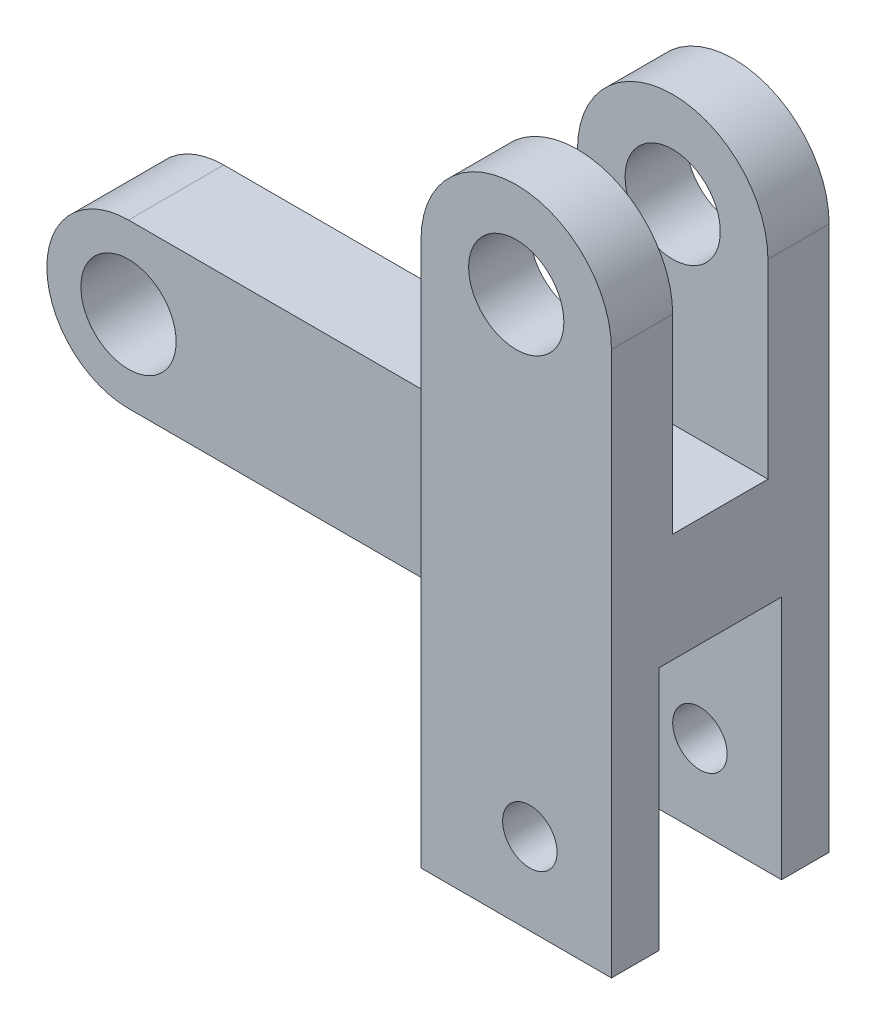
from build123d import *
from build123d.topology import SkipClean

# Parameters (mm, degrees)
SKETCH_1_W          = 7
SKETCH_1_H          = 7
EXTRUDE_1_DEPTH     = 2.4
EXTRUDE_6_DEPTH     = 1.75
EXTRUDE_START       = -5.25
EXTRUDE_8_DEPTH     = 1.75
SKETCH_11_R         = 1.75
CUT_EXTRUDE_1_DEPTH = 17.740669043
SKETCH_17_W         = 7
SKETCH_17_H         = 7
EXTRUDE_10_DEPTH    = 10
SKETCH_15_R         = 1.75
EXTRUDE_9_DEPTH     = 1.75
SKETCH_12_R         = 1
CUT_EXTRUDE_2_DEPTH = 23.383029286
SKETCH_18_W         = 7
SKETCH_18_H         = 4.5
CUT_EXTRUDE_4_DEPTH = 9
SKETCH_19_R         = 1
SKETCH_19_R_2       = 1.75
EXTRUDE_11_DEPTH    = 0.5
EXTRUDE_START_2     = 0.5
SKETCH_20_R         = 1
SKETCH_20_R_2       = 1.75
EXTRUDE_12_DEPTH    = 0.5


with BuildPart() as part:
    # 草图1 → 凸台-拉伸1 (new body)
    with BuildSketch(Plane(origin=(0, 0, 0), x_dir=(1, 0, 0), z_dir=(0, 1, 0))):
        with Locations((3.5, 0)):
            Rectangle(SKETCH_1_W, SKETCH_1_H)
    extrude(amount=EXTRUDE_1_DEPTH)

    # 草图10 → 凸台-拉伸6 (add)
    with BuildSketch(Plane(origin=(0, 0, -3.5), x_dir=(-1, 0, 0), z_dir=(0, 0, -1))):
        with BuildLine():
            Line((-7, 10), (-7, 2.4))
            Line((-7, 2.4), (0, 2.4))
            Line((0, 2.4), (0, 10))
            ThreePointArc((0, 10), (-3.5, 13.5), (-7, 10))
        make_face()
    extrude(amount=-EXTRUDE_6_DEPTH)

    # 草图10<2> → 凸台-拉伸8 (add)
    with BuildSketch(Plane(origin=(0, 0, -3.5), x_dir=(-1, 0, 0), z_dir=(0, 0, -1)).offset(EXTRUDE_START)):
        with BuildLine():
            Line((-7, 10), (-7, 2.4))
            Line((-7, 2.4), (0, 2.4))
            Line((0, 2.4), (0, 10))
            ThreePointArc((0, 10), (-3.5, 13.5), (-7, 10))
        make_face()
    extrude(amount=-EXTRUDE_8_DEPTH)

    # 草图11 → 切除-拉伸1 (cut, through all)
    with BuildSketch(Plane(origin=(0, 0, -3.5), x_dir=(-1, 0, 0), z_dir=(0, 0, -1))):
        with Locations((-3.5, 10)):
            Circle(SKETCH_11_R)
    extrude(amount=-CUT_EXTRUDE_1_DEPTH, mode=Mode.SUBTRACT)

    # 草图17 → 凸台-拉伸10 (add)
    with BuildSketch(Plane.XZ):
        with Locations((3.5, 0)):
            Rectangle(SKETCH_17_W, SKETCH_17_H)
    extrude(amount=EXTRUDE_10_DEPTH)

    # 草图15 → 凸台-拉伸9 (add, symmetric)
    with BuildSketch(Plane.XY):
        with BuildLine():
            Line((7, 2.4), (7, 3))
            Line((7, 3), (-13, 3))
            ThreePointArc((-13, 3), (-16, 0), (-13, -3))
            Line((-13, -3), (7, -3))
            Line((7, -3), (7, 2.4))
        make_face()
        with Locations((-13, 0)):
            Circle(SKETCH_15_R, mode=Mode.SUBTRACT)
    extrude(amount=EXTRUDE_9_DEPTH, both=True)

    # 草图12 → 切除-拉伸2 (cut, through all)
    with BuildSketch(Plane(origin=(0, 4, 3.5), x_dir=(1, 0, 0), z_dir=(0, 0, -1))):
        with Locations((4, 11)):
            Circle(SKETCH_12_R)
    extrude(amount=CUT_EXTRUDE_2_DEPTH, mode=Mode.SUBTRACT)

    # 草图18 → 切除-拉伸4 (cut)
    with BuildSketch(Plane(origin=(7.4, -10, 0), x_dir=(1, 0, 0), z_dir=(0, 1, 0))):
        with Locations((-3.9, 0)):
            Rectangle(SKETCH_18_W, SKETCH_18_H)
    extrude(amount=CUT_EXTRUDE_4_DEPTH, mode=Mode.SUBTRACT)

    # 草图19 → 凸台-拉伸11 (add)
    with SkipClean():  # the faces are left unmerged after this step: merging them gives an invalid solid
        with BuildSketch(Plane.XY.offset(3.5)):
            with BuildLine():
                Line((0, 10), (0, -10))
                Line((0, -10), (7, -10))
                Line((7, -10), (7, 10))
                ThreePointArc((7, 10), (3.5, 13.5), (0, 10))
            make_face()
            with Locations((4, -7)):
                Circle(SKETCH_19_R, mode=Mode.SUBTRACT)
            with Locations((3.5, 10)):
                Circle(SKETCH_19_R_2, mode=Mode.SUBTRACT)
        extrude(amount=EXTRUDE_11_DEPTH)

    # 草图20 → 凸台-拉伸12 (add)
    with SkipClean():  # the faces are left unmerged after this step: merging them gives an invalid solid
        with BuildSketch(Plane(origin=(0, 0, -3.5), x_dir=(-1, 0, 0), z_dir=(0, 0, -1)).offset(EXTRUDE_START_2)):
            with BuildLine():
                Line((-7, 10), (-7, -10))
                Line((-7, -10), (0, -10))
                Line((0, -10), (0, 10))
                ThreePointArc((0, 10), (-3.5, 13.5), (-7, 10))
            make_face()
            with Locations((-4, -7)):
                Circle(SKETCH_20_R, mode=Mode.SUBTRACT)
            with Locations((-3.5, 10)):
                Circle(SKETCH_20_R_2, mode=Mode.SUBTRACT)
        extrude(amount=-EXTRUDE_12_DEPTH)


solid = part.part
